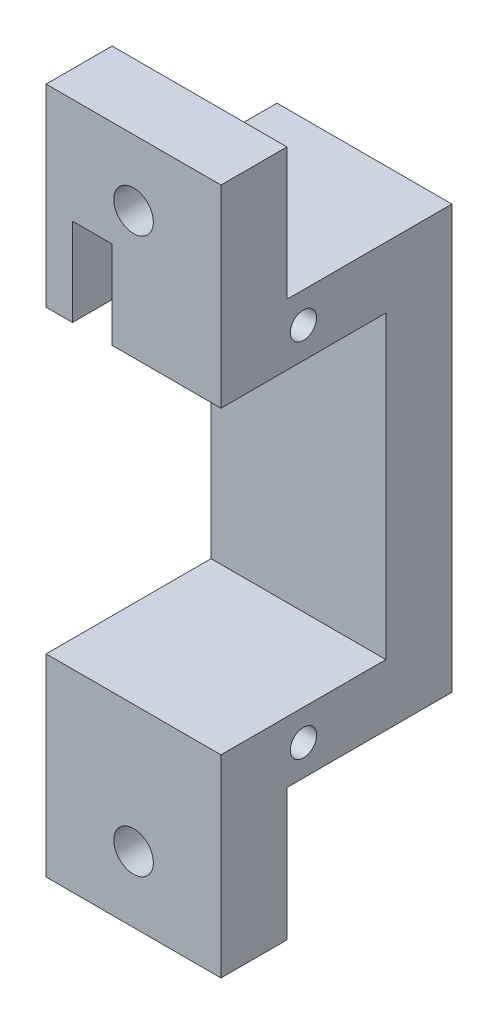
from build123d import *

# Parameters (mm, degrees)
ESBO_O1_W                = 13.25
ESBO_O1_H                = 12.5
RESSALTO_EXTRUS_O1_DEPTH = 4.65
ESBO_O2_W                = 13.25
ESBO_O2_H                = 32.05
RESSALTO_EXTRUS_O2_DEPTH = 5
ESBO_O3_W                = 13.25
ESBO_O3_H                = 4.65
RESSALTO_EXTRUS_O3_DEPTH = 12.5
ESBO_O4_W                = 13.25
ESBO_O4_H                = 5
RESSALTO_EXTRUS_O4_DEPTH = 10
ESBO_O5_W                = 13.25
ESBO_O5_H                = 5
RESSALTO_EXTRUS_O5_DEPTH = 10
ESBO_O6_R                = 1.5
CORTE_EXTRUS_O1_DEPTH    = 10
ESBO_O7_R                = 1
CORTE_EXTRUS_O2_DEPTH    = 48.87512604
ESBO_O8_R                = 1
CORTE_EXTRUS_O3_DEPTH    = 48.87512604
ESBO_O9_W                = 3
ESBO_O9_H                = 10.390977072
CORTE_EXTRUS_O4_DEPTH    = 10
ESBO_O10_W               = 3
ESBO_O10_H               = 2
CORTE_EXTRUS_O5_DEPTH    = 10


with BuildPart() as part:
    # Esboço1 → Ressalto-extrusão1 (new body)
    with BuildSketch(Plane(origin=(0, 0, 0), x_dir=(1, 0, 0), z_dir=(0, 1, 0))):
        with Locations((-15.112918198, -12.411797698)):
            Rectangle(ESBO_O1_W, ESBO_O1_H)
    extrude(amount=-RESSALTO_EXTRUS_O1_DEPTH)

    # Esboço2 → Ressalto-extrusão2 (add)
    with BuildSketch(Plane(origin=(0, 0, 6.161797698), x_dir=(-1, 0, 0), z_dir=(0, 0, -1))):
        with Locations((15.112918198, -16.025)):
            Rectangle(ESBO_O2_W, ESBO_O2_H)
    extrude(amount=RESSALTO_EXTRUS_O2_DEPTH)

    # Esboço3 → Ressalto-extrusão3 (add)
    with BuildSketch(Plane.XY.offset(6.161797698)):
        with Locations((-15.112918198, -29.725)):
            Rectangle(ESBO_O3_W, ESBO_O3_H)
    extrude(amount=RESSALTO_EXTRUS_O3_DEPTH)

    # Esboço4 → Ressalto-extrusão4 (add)
    with BuildSketch(Plane(origin=(0, -32.05, 0), x_dir=(-1, 0, 0), z_dir=(0, -1, 0))):
        with Locations((15.112918198, -16.161797698)):
            Rectangle(ESBO_O4_W, ESBO_O4_H)
    extrude(amount=RESSALTO_EXTRUS_O4_DEPTH)

    # Esboço5 → Ressalto-extrusão5 (add)
    with BuildSketch(Plane(origin=(0, 0, 0), x_dir=(1, 0, 0), z_dir=(0, 1, 0))):
        with Locations((-15.112918198, -16.161797698)):
            Rectangle(ESBO_O5_W, ESBO_O5_H)
    extrude(amount=RESSALTO_EXTRUS_O5_DEPTH)

    # Esboço6 → Corte-extrusão1 (cut)
    with BuildSketch(Plane(origin=(0, 0, 13.661797698), x_dir=(-1, 0, 0), z_dir=(0, 0, -1))):
        with Locations((15.112918198, 5)):
            Circle(ESBO_O6_R)
        with Locations((15.112918198, -37.05)):
            Circle(ESBO_O6_R)
    extrude(amount=-CORTE_EXTRUS_O1_DEPTH, mode=Mode.SUBTRACT)

    # Esboço7 → Corte-extrusão2 (cut, through all)
    with BuildSketch(Plane(origin=(-8.487918198, 0, 0), x_dir=(0, 0, -1), z_dir=(1, 0, 0))):
        with Locations((-12.411797698, -2.325)):
            Circle(ESBO_O7_R)
    extrude(amount=-CORTE_EXTRUS_O2_DEPTH, mode=Mode.SUBTRACT)

    # Esboço8 → Corte-extrusão3 (cut, through all)
    with BuildSketch(Plane(origin=(-8.487918198, 0, 0), x_dir=(0, 0, -1), z_dir=(1, 0, 0))):
        with Locations((-12.411797698, -29.725)):
            Circle(ESBO_O8_R)
    extrude(amount=-CORTE_EXTRUS_O3_DEPTH, mode=Mode.SUBTRACT)

    # Esboço9 → Corte-extrusão4 (cut)
    with BuildSketch(Plane(origin=(0, 0, 0), x_dir=(1, 0, 0), z_dir=(0, 1, 0))):
        with Locations((-18.237918198, -13.466309162)):
            Rectangle(ESBO_O9_W, ESBO_O9_H)
    extrude(amount=-CORTE_EXTRUS_O4_DEPTH, mode=Mode.SUBTRACT)

    # Esboço10 → Corte-extrusão5 (cut)
    with BuildSketch(Plane(origin=(0, 0, 13.661797698), x_dir=(-1, 0, 0), z_dir=(0, 0, -1))):
        with Locations((18.237918198, 1)):
            Rectangle(ESBO_O10_W, ESBO_O10_H)
    extrude(amount=-CORTE_EXTRUS_O5_DEPTH, mode=Mode.SUBTRACT)


solid = part.part
